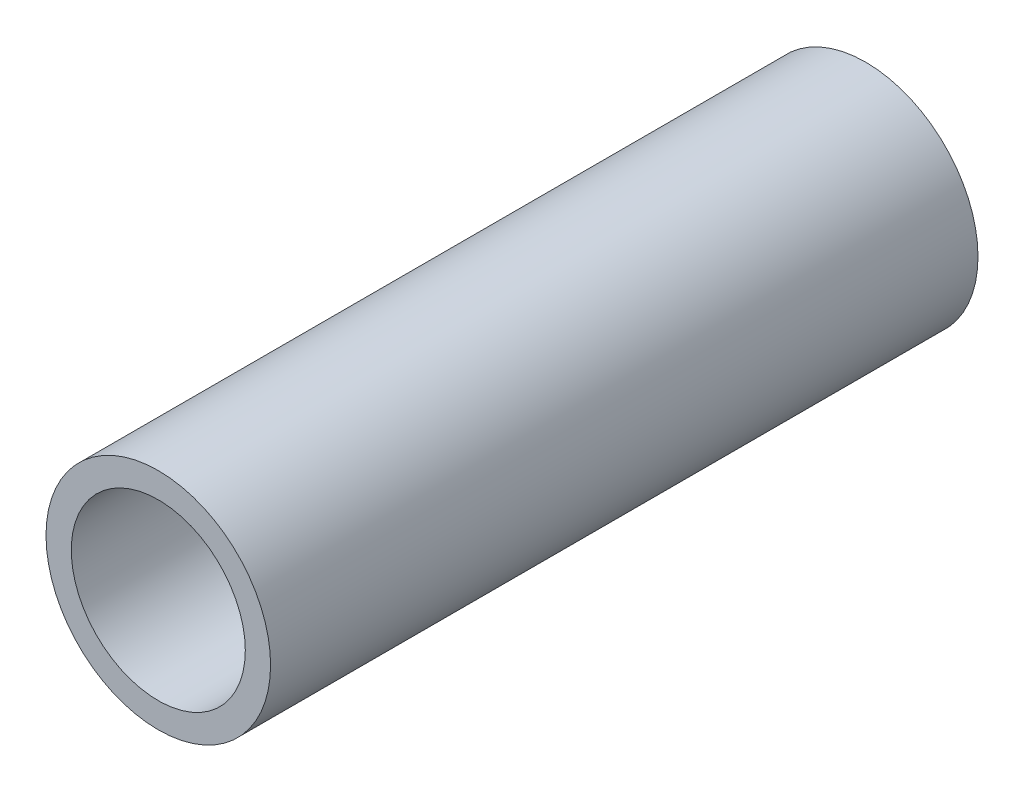
from build123d import *

# Parameters (mm, degrees)
SKETCH_1_R      = 1
SKETCH_1_R_2    = 0.775
EXTRUDE_1_DEPTH = 6.3


with BuildPart() as part:
    # Эскиз1 → Бобышка-Вытянуть1 (new body)
    with BuildSketch(Plane.XY):
        Circle(SKETCH_1_R)
        Circle(SKETCH_1_R_2, mode=Mode.SUBTRACT)
    extrude(amount=EXTRUDE_1_DEPTH)


solid = part.part
